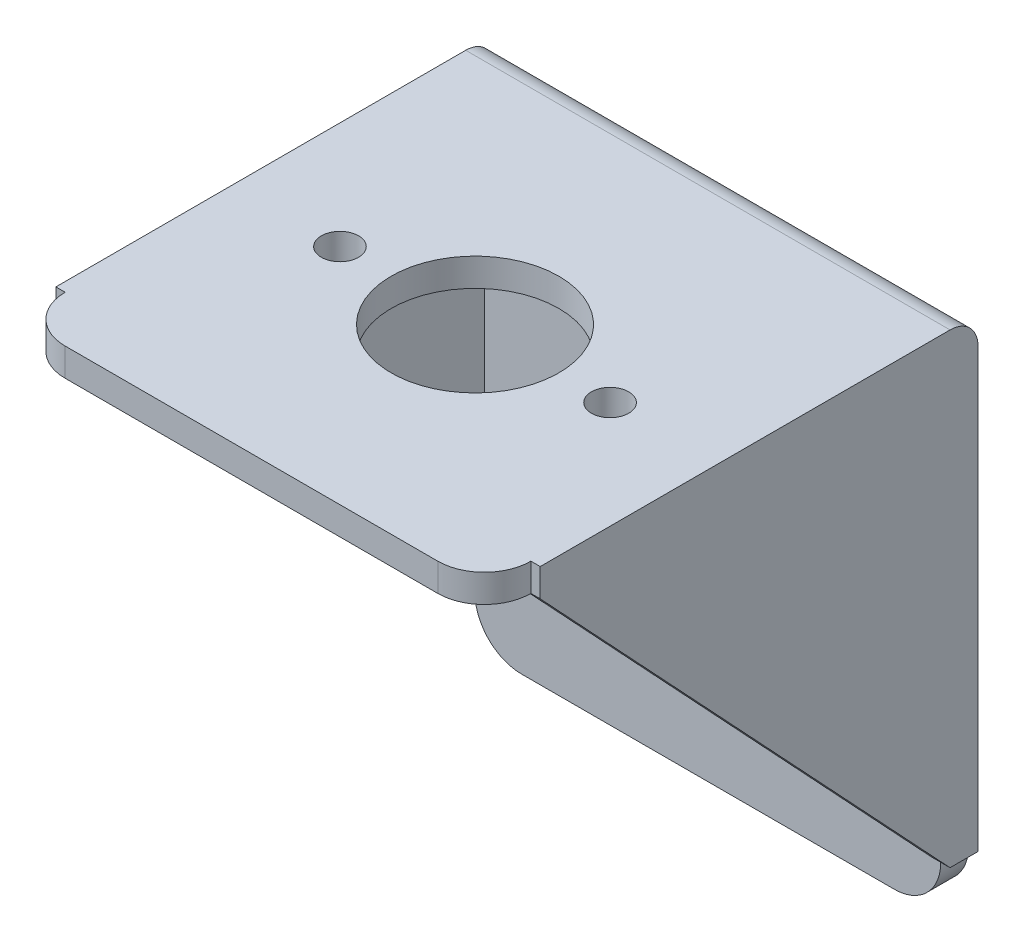
from build123d import *

# Parameters (mm, degrees)
SKETCH1_W                  = 52
SKETCH1_H                  = 55
BOSS_EXTRUDE1_DEPTH        = 50
SKETCH2_W                  = 49
SKETCH2_H                  = 52
CUT_EXTRUDE1_DEPTH         = 89.926936302
CUT_EXTRUDE2_DEPTH         = 89.926936302
CUT_EXTRUDE3_DEPTH         = 89.926936302
CUT_EXTRUDE4_DEPTH         = 89.926936302
CUT_EXTRUDE5_DEPTH         = 88.206651122
F_18_0_18_DIAMETER_HOLE1_D = 18
F_4_0_4_DIAMETER_HOLE1_D   = 4
FILLET1_R                  = 3
FILLET2_R                  = 5
BOSS_EXTRUDE2_DEPTH        = 1
BOSS_EXTRUDE3_DEPTH        = 1
BOSS_EXTRUDE4_START        = 1
BOSS_EXTRUDE4_DEPTH        = 1
BOSS_EXTRUDE5_DEPTH        = 1


with BuildPart() as part:
    # Sketch1 → Boss-Extrude1 (new body)
    with BuildSketch(Plane(origin=(50, 0, 0), x_dir=(0, 0, -1), z_dir=(1, 0, 0))):
        with Locations((-26, -24.5)):
            Rectangle(SKETCH1_W, SKETCH1_H)
    extrude(amount=-BOSS_EXTRUDE1_DEPTH)

    # Sketch2 → Cut-Extrude1 (cut, through all)
    with BuildSketch(Plane.ZY):
        with Locations((27.5, -26)):
            Rectangle(SKETCH2_W, SKETCH2_H)
    extrude(amount=-CUT_EXTRUDE1_DEPTH, mode=Mode.SUBTRACT)

    # Sketch3 → Cut-Extrude2 (cut, through all)
    with BuildSketch(Plane(origin=(0, 0, 0), x_dir=(-1, 0, 0), z_dir=(0, 0, -1))):
        with BuildLine():
            Line((-33.1, -37.9), (-38.900000611, -37.9))
            ThreePointArc((-38.900000611, -37.9), (-41.000000611, -40), (-38.900000611, -42.1))
            Line((-38.900000611, -42.1), (-33.1, -42.1))
            ThreePointArc((-33.1, -42.1), (-31, -40), (-33.1, -37.9))
        make_face()
    extrude(amount=-CUT_EXTRUDE2_DEPTH, mode=Mode.SUBTRACT)

    # Sketch4 → Cut-Extrude3 (cut, through all)
    with BuildSketch(Plane(origin=(0, 0, 0), x_dir=(-1, 0, 0), z_dir=(0, 0, -1))):
        with BuildLine():
            Line((-16.9, -14.1), (-11.1, -14.1))
            ThreePointArc((-11.1, -14.1), (-9, -12), (-11.1, -9.9))
            Line((-11.1, -9.9), (-16.9, -9.9))
            ThreePointArc((-16.9, -9.9), (-19, -12), (-16.9, -14.1))
        make_face()
    extrude(amount=-CUT_EXTRUDE3_DEPTH, mode=Mode.SUBTRACT)

    # Sketch5 → Cut-Extrude4 (cut, through all)
    with BuildSketch(Plane(origin=(0, 0, 0), x_dir=(-1, 0, 0), z_dir=(0, 0, -1))):
        with BuildLine():
            Line((-16.9, -42.1), (-11.1, -42.1))
            ThreePointArc((-11.1, -42.1), (-9, -40), (-11.1, -37.9))
            Line((-11.1, -37.9), (-16.9, -37.9))
            ThreePointArc((-16.9, -37.9), (-19, -40), (-16.9, -42.1))
        make_face()
    extrude(amount=-CUT_EXTRUDE4_DEPTH, mode=Mode.SUBTRACT)

    # Sketch6 → Cut-Extrude5 (cut, through all)
    with BuildSketch(Plane.XY.offset(3)):
        with BuildLine():
            Line((38.9, -9.9), (33.1, -9.9))
            ThreePointArc((33.1, -9.9), (31, -12), (33.1, -14.1))
            Line((33.1, -14.1), (38.9, -14.1))
            ThreePointArc((38.9, -14.1), (41, -12), (38.9, -9.9))
        make_face()
    extrude(amount=-CUT_EXTRUDE5_DEPTH, mode=Mode.SUBTRACT)

    # Ø18.0 (18) Diameter Hole1 (through all)
    with Locations(Plane(origin=(0, 0, 0), x_dir=(-1, 0, 0), z_dir=(0, -1, 0))):
        with Locations((-25, -28)):
            Hole(F_18_0_18_DIAMETER_HOLE1_D / 2)

    # Ø4.0 (4) Diameter Hole1 (through all)
    with Locations(Plane(origin=(0, 0, 0), x_dir=(-1, 0, 0), z_dir=(0, -1, 0))):
        with Locations((-10.5, -28), (-39.5, -28)):
            Hole(F_4_0_4_DIAMETER_HOLE1_D / 2)

    # Fillet1
    fillet1_edges = [part.edges().sort_by_distance(p)[0] for p in [
        (25, 3, 0),
    ]]
    fillet(fillet1_edges, radius=FILLET1_R)

    # Fillet2
    fillet2_edges = [part.edges().sort_by_distance(p)[0] for p in [
        (50, -52, 1.5),
        (0, -52, 1.5),
        (0, 1.5, 52),
        (50, 1.5, 52),
    ]]
    fillet(fillet2_edges, radius=FILLET2_R)

    # Sketch12 → Boss-Extrude2 (add)
    with BuildSketch(Plane.ZY):
        Polygon((3, -47), (47, 0), (3, 0), align=None)
    extrude(amount=-BOSS_EXTRUDE2_DEPTH)

    # Sketch13 → Boss-Extrude3 (add)
    with BuildSketch(Plane(origin=(50, 0, 0), x_dir=(0, 0, -1), z_dir=(1, 0, 0))):
        Polygon((-3, -47), (-3, 0), (-47, 0), align=None)
    extrude(amount=-BOSS_EXTRUDE3_DEPTH)

    # Sketch14 → Boss-Extrude4 (add)
    with BuildSketch(Plane.ZY.offset(BOSS_EXTRUDE4_START)):
        with BuildLine():
            Line((0, 0), (0, -47))
            Line((0, -47), (3, -47))
            Line((3, -47), (47, 0))
            Line((47, 0), (47, 3))
            Line((47, 3), (3, 3))
            ThreePointArc((3, 3), (0.878679656, 2.121320344), (0, 0))
        make_face()
    extrude(amount=-BOSS_EXTRUDE4_DEPTH)

    # Sketch15 → Boss-Extrude5 (add)
    with BuildSketch(Plane(origin=(50, 0, 0), x_dir=(0, 0, -1), z_dir=(1, 0, 0))):
        with BuildLine():
            Line((-3, 3), (-47, 3))
            Line((-47, 3), (-47, 0))
            Line((-47, 0), (-3, -47))
            Line((-3, -47), (0, -47))
            Line((0, -47), (0, 0))
            ThreePointArc((0, 0), (-0.878679656, 2.121320344), (-3, 3))
        make_face()
    extrude(amount=BOSS_EXTRUDE5_DEPTH)


solid = part.part
